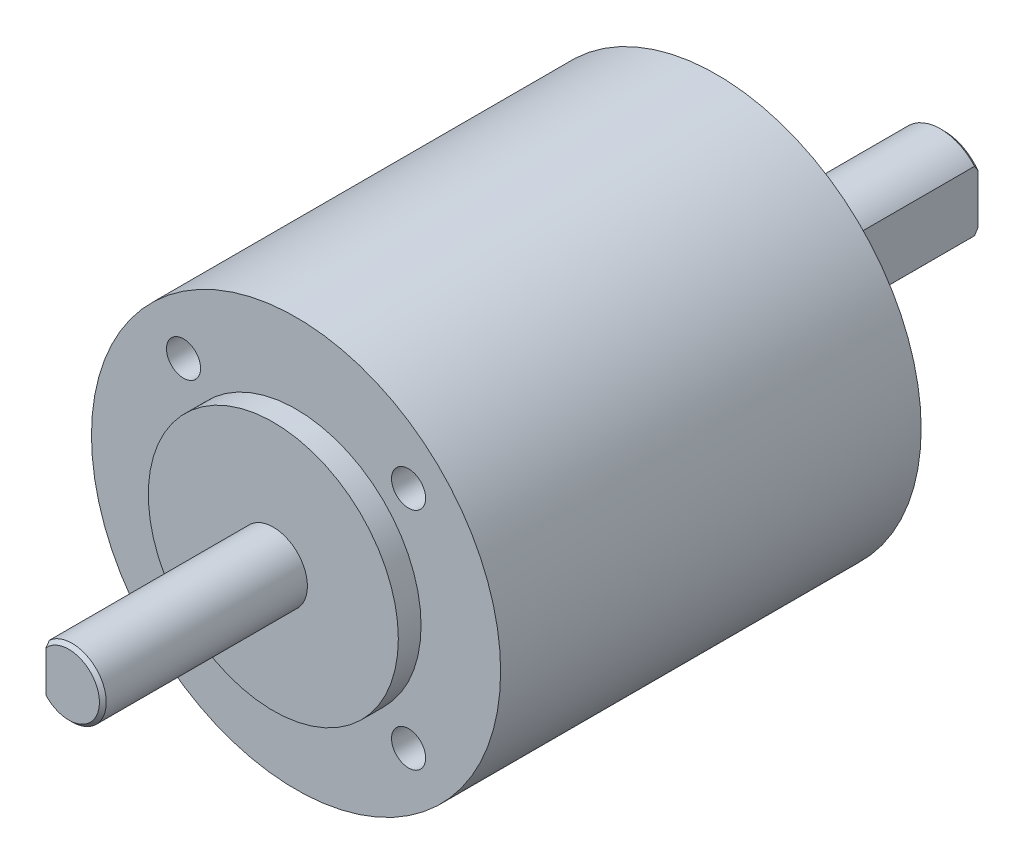
from build123d import *

# Parameters (mm, degrees)
SKETCH_1_R          = 18
EXTRUDE_1_DEPTH     = 18.5
SKETCH_2_R          = 3
EXTRUDE_2_DEPTH     = 20
SKETCH_3_R          = 11
EXTRUDE_3_DEPTH     = 2
SKETCH_4_R          = 1.5
CUT_EXTRUDE_1_DEPTH = 8
SKETCH_5_R          = 4
EXTRUDE_4_DEPTH     = 20
EXTRUDE_START       = 2
SKETCH_6_R          = 11
EXTRUDE_5_DEPTH     = 2
CUT_EXTRUDE_START   = -8
SKETCH_7_R          = 1.5
CUT_EXTRUDE_2_DEPTH = 8
CUT_EXTRUDE_START_2 = -15
CUT_EXTRUDE_3_DEPTH = 15
CUT_EXTRUDE_4_DEPTH = 15
CHAMFER_1_SIZE      = 0.3


with BuildPart() as part:
    # 草图1 → 凸台-拉伸1 (new, symmetric)
    with BuildSketch(Plane.XY):
        Circle(SKETCH_1_R)
    extrude(amount=EXTRUDE_1_DEPTH, both=True)

    # 草图2 → 凸台-拉伸2 (add)
    with BuildSketch(Plane.XY.offset(18.5)):
        Circle(SKETCH_2_R)
    extrude(amount=EXTRUDE_2_DEPTH)

    # 草图3 → 凸台-拉伸3 (add)
    with BuildSketch(Plane.XY.offset(18.5)):
        Circle(SKETCH_3_R)
    extrude(amount=EXTRUDE_3_DEPTH)

    # 草图4 → 切除-拉伸1 (cut)
    with BuildSketch(Plane.XY.offset(18.5)):
        with Locations((-9.899494937, 9.899494937)):
            Circle(SKETCH_4_R)
        with Locations((9.899494937, 9.899494937)):
            Circle(SKETCH_4_R)
        with Locations((9.899494937, -9.899494937)):
            Circle(SKETCH_4_R)
        with Locations((-9.899494937, -9.899494937)):
            Circle(SKETCH_4_R)
    extrude(amount=-CUT_EXTRUDE_1_DEPTH, mode=Mode.SUBTRACT)

    # 草图5 → 凸台-拉伸4 (add)
    with BuildSketch(Plane(origin=(0, 0, -18.5), x_dir=(-1, 0, 0), z_dir=(0, 0, -1))):
        Circle(SKETCH_5_R)
    extrude(amount=EXTRUDE_4_DEPTH)

    # 草图6 → 凸台-拉伸5 (add)
    with BuildSketch(Plane(origin=(0, 0, -18.5), x_dir=(-1, 0, 0), z_dir=(0, 0, -1)).offset(EXTRUDE_START)):
        with Locations(Location((0, 0, 0), (0, 0, 180))):
            Circle(SKETCH_6_R)
    extrude(amount=-EXTRUDE_5_DEPTH)

    # 草图7 → 切除-拉伸2 (cut)
    with BuildSketch(Plane(origin=(0, 0, -18.5), x_dir=(-1, 0, 0), z_dir=(0, 0, -1)).offset(CUT_EXTRUDE_START)):
        with Locations(Location((-9.899494937, 9.899494937, 0), (0, 0, 180))):
            Circle(SKETCH_7_R)
        with Locations(Location((9.899494937, 9.899494937, 0), (0, 0, 180))):
            Circle(SKETCH_7_R)
        with Locations(Location((9.899494937, -9.899494937, 0), (0, 0, 180))):
            Circle(SKETCH_7_R)
        with Locations(Location((-9.899494937, -9.899494937, 0), (0, 0, 180))):
            Circle(SKETCH_7_R)
    extrude(amount=CUT_EXTRUDE_2_DEPTH, mode=Mode.SUBTRACT)

    # 草图8 → 切除-拉伸3 (cut)
    with BuildSketch(Plane.XY.offset(38.5).offset(CUT_EXTRUDE_START_2)):
        with BuildLine():
            Line((-2, 2.236067977), (-2, -2.236067977))
            ThreePointArc((-2, -2.236067977), (-3, 0), (-2, 2.236067977))
        make_face()
    extrude(amount=CUT_EXTRUDE_3_DEPTH, mode=Mode.SUBTRACT)

    # 草图9 → 切除-拉伸4 (cut)
    with BuildSketch(Plane(origin=(0, 0, -38.5), x_dir=(-1, 0, 0), z_dir=(0, 0, -1)).offset(CUT_EXTRUDE_START_2)):
        with BuildLine():
            Line((-3, 2.645751311), (-3, -2.645751311))
            ThreePointArc((-3, -2.645751311), (-4, 0), (-3, 2.645751311))
        make_face()
    extrude(amount=CUT_EXTRUDE_4_DEPTH, mode=Mode.SUBTRACT)

    # 倒角1
    chamfer_1_edges = [part.edges().sort_by_distance(p)[0] for p in [
        (1.224744871, -2.738612788, 38.5),
        (-1.414213562, -3.741657387, -38.5),
    ]]
    chamfer(chamfer_1_edges, length=CHAMFER_1_SIZE)


solid = part.part
